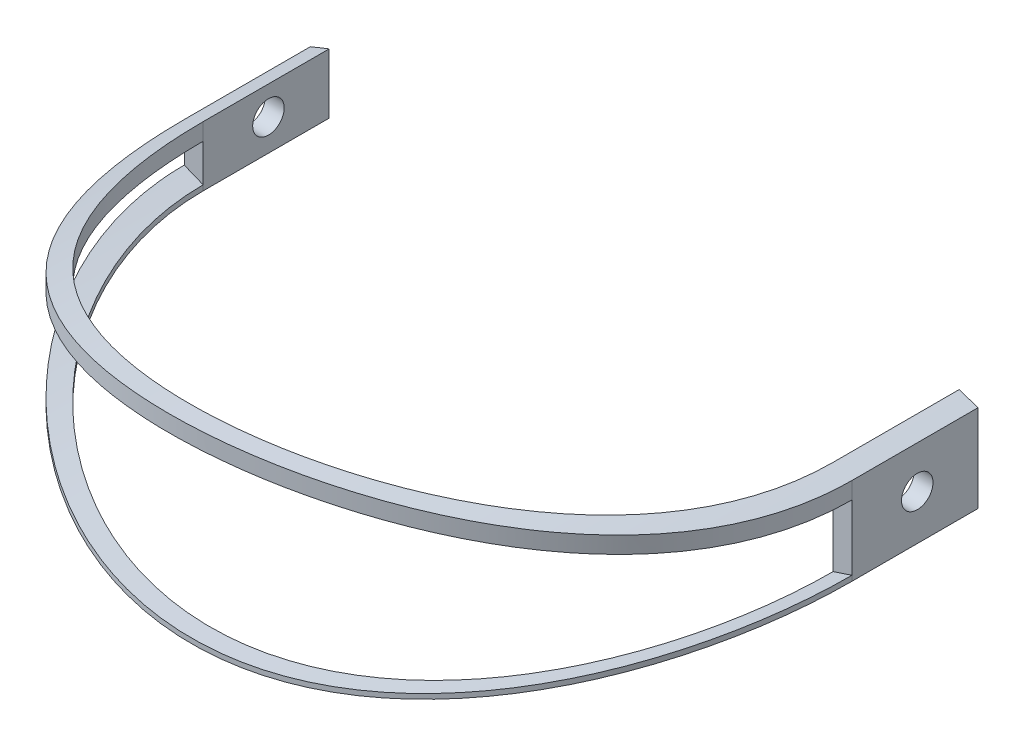
from build123d import *

# Parameters (mm, degrees)
EXTRUDE_1_DEPTH          = 5
CUT_EXTRUDE_1_DEPTH      = 10.009994451
CUT_EXTRUDE_1_DEPTH_BACK = 10.009994451
SKETCH_2_OUTSIDE_W       = 15.86
SKETCH_2_OUTSIDE_H       = 15.26
CUT_EXTRUDE_3_DEPTH      = 8.698899932
SKETCH_4_R               = 0.25
CUT_EXTRUDE_4_DEPTH      = 12.980945757


with BuildPart() as part:
    # 草图1 → 拉伸-薄壁1 (new, symmetric)
    with BuildSketch(Plane(origin=(0, 0, 0), x_dir=(1, 0, 0), z_dir=(0, 1, 0))):
        with BuildLine():
            Line((5, 2), (5, 0))
            ThreePointArc((5, 0), (0, -5), (-5, 0))
            Line((-5, 0), (-5, 2))
            Line((-5, 2), (-5.3, 2))
            Line((-5.3, 2), (-5.3, 0))
            ThreePointArc((-5.3, 0), (0, -5.3), (5.3, 0))
            Line((5.3, 0), (5.3, 2))
            Line((5.3, 2), (5, 2))
        make_face()
    extrude(amount=EXTRUDE_1_DEPTH, both=True)

    # 草图2 outside → 切除-拉伸1 (cut, two sides: drawn at the far end of the back side and taken through both)
    with BuildSketch(Plane.XY.offset(-CUT_EXTRUDE_1_DEPTH_BACK)):
        Rectangle(SKETCH_2_OUTSIDE_W, SKETCH_2_OUTSIDE_H)
        with BuildLine():
            ThreePointArc((-6.091957351, 0.258709088), (0.446391065, -1.241290912), (6.98473948, 0.258709088))
            ThreePointArc((6.98473948, 0.258709088), (0.446391065, 1.758709088), (-6.091957351, 0.258709088))
        make_face(mode=Mode.SUBTRACT)
    extrude(amount=CUT_EXTRUDE_1_DEPTH + CUT_EXTRUDE_1_DEPTH_BACK, mode=Mode.SUBTRACT)

    # 草图3 → 切除-拉伸3 (cut, through all)
    with BuildSketch(Plane.XY):
        with BuildLine():
            ThreePointArc((-5.709798578, 0.166145361), (0.446391065, 1.49525914), (6.602580707, 0.166145361))
            Line((6.602580707, 0.166145361), (-5.709798578, 0.166145361))
        make_face()
        with BuildLine():
            Line((-5.709798578, 0.166145361), (6.602580707, 0.166145361))
            ThreePointArc((6.602580707, 0.166145361), (0.446391065, -1.162968417), (-5.709798578, 0.166145361))
        make_face()
    extrude(amount=CUT_EXTRUDE_3_DEPTH, mode=Mode.SUBTRACT)

    # 草图4 → 切除-拉伸4 (cut, through all)
    with BuildSketch(Plane(origin=(5.3, 0, 0), x_dir=(0, 0, -1), z_dir=(1, 0, 0))):
        with Locations((1.035921509, 0.281600465)):
            Circle(SKETCH_4_R)
    extrude(amount=-CUT_EXTRUDE_4_DEPTH, mode=Mode.SUBTRACT)


solid = part.part
